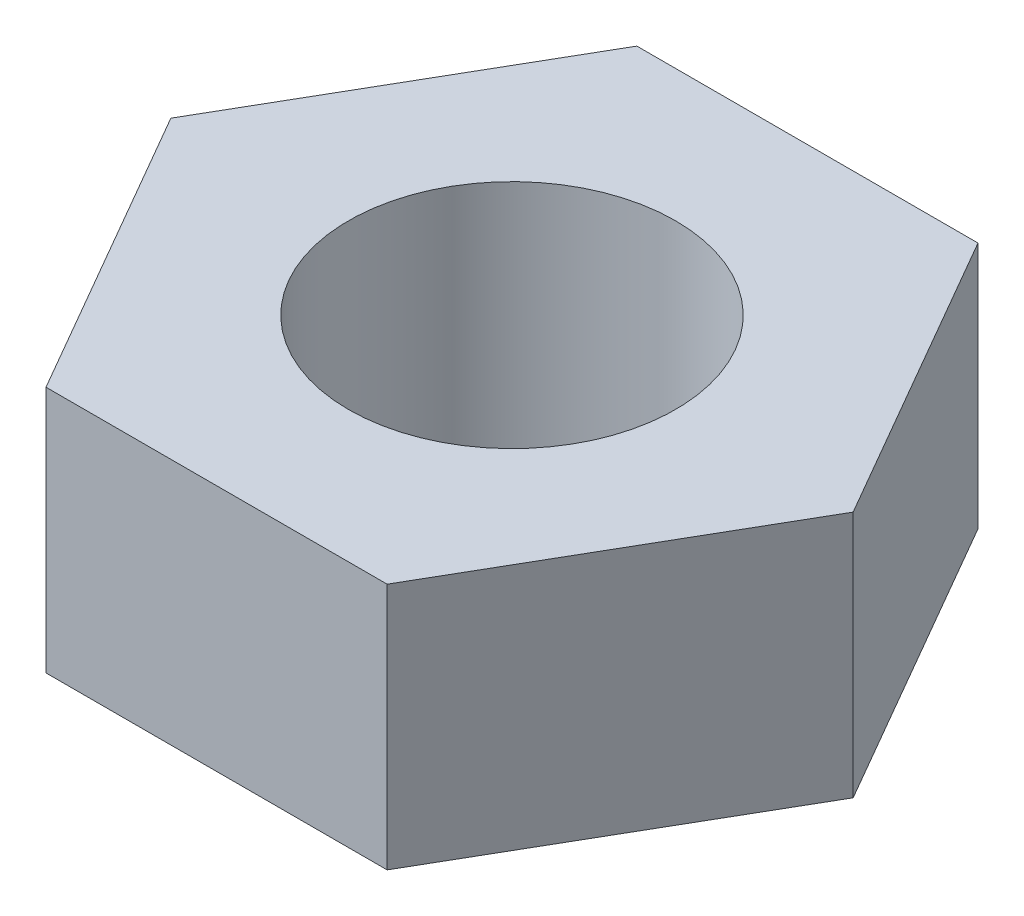
from build123d import *

# Parameters (mm, degrees)
BOSS_EXTRUDE1_DEPTH = 2.27
SKETCH2_R           = 1.5
CUT_EXTRUDE1_DEPTH  = 2.27


with BuildPart() as part:
    # Sketch1 → Boss-Extrude1 (new body)
    with BuildSketch(Plane(origin=(0, 0, 0), x_dir=(1, 0, 0), z_dir=(0, 1, 0))):
        Polygon((3.129238459, 0), (1.56461923, 2.71), (-1.56461923, 2.71), (-3.129238459, 0), (-1.56461923, -2.71), (1.56461923, -2.71), align=None)
    extrude(amount=BOSS_EXTRUDE1_DEPTH)

    # Sketch2 → Cut-Extrude1 (cut)
    with BuildSketch(Plane(origin=(0, 2.27, 0), x_dir=(1, 0, 0), z_dir=(0, 1, 0))):
        with Locations(Location((0, 0, 0), (0, 0, 270))):
            Circle(SKETCH2_R)
    extrude(amount=-CUT_EXTRUDE1_DEPTH, mode=Mode.SUBTRACT)


solid = part.part
